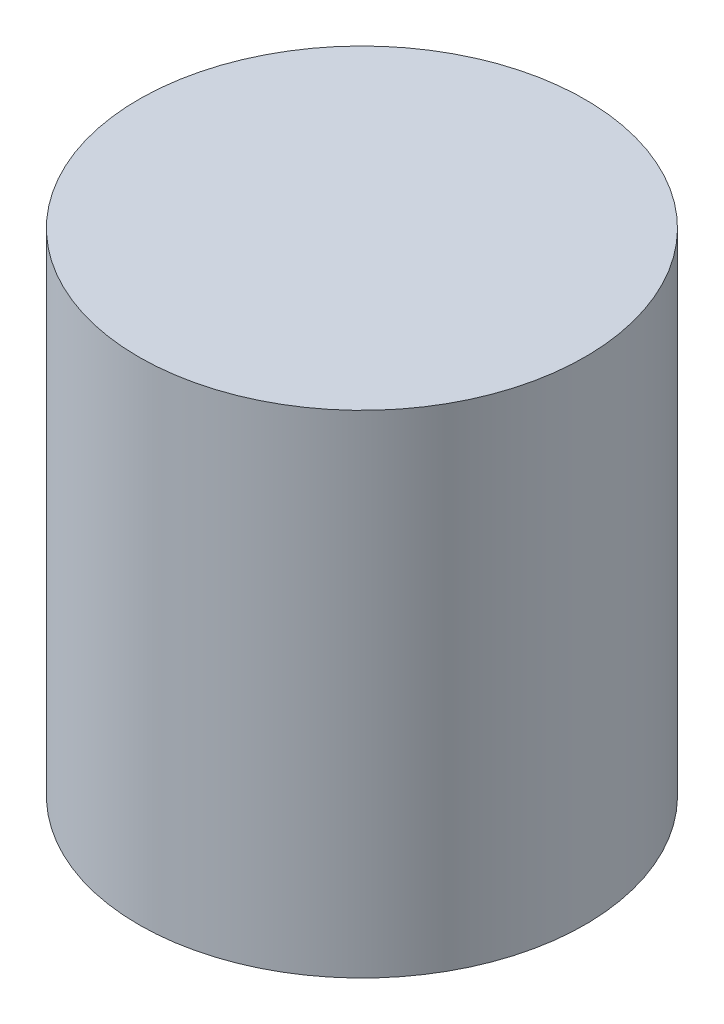
from build123d import *

# Parameters (mm, degrees)
SKETCH1_R           = 29.5
BOSS_EXTRUDE1_DEPTH = 65
SKETCH2_R           = 26
CUT_EXTRUDE1_DEPTH  = 58.65


with BuildPart() as part:
    # Sketch1 → Boss-Extrude1 (new body)
    with BuildSketch(Plane(origin=(0, 0, 0), x_dir=(1, 0, 0), z_dir=(0, 1, 0))):
        with Locations(Location((0, 0, 0), (0, 0, 270))):
            Circle(SKETCH1_R)
    extrude(amount=BOSS_EXTRUDE1_DEPTH)

    # Sketch2 → Cut-Extrude1 (cut)
    with BuildSketch(Plane.XZ):
        with Locations(Location((0, 0, 0), (0, 0, 270))):
            Circle(SKETCH2_R)
    extrude(amount=-CUT_EXTRUDE1_DEPTH, mode=Mode.SUBTRACT)


solid = part.part
